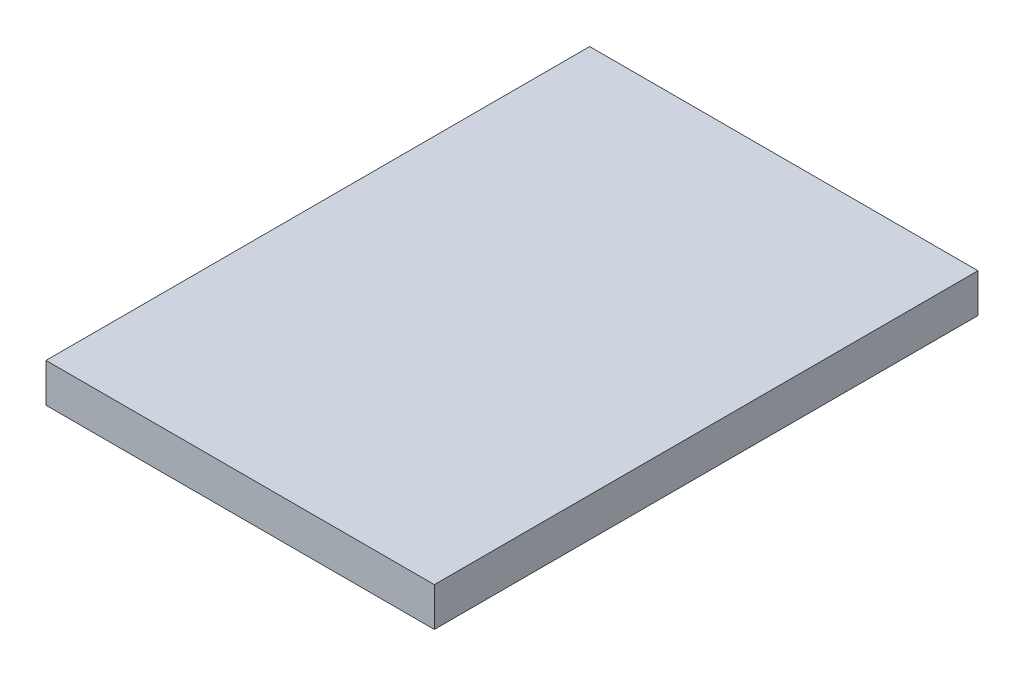
from build123d import *

# Parameters (mm, degrees)
SKETCH1_W           = 20
SKETCH1_H           = 28
BOSS_EXTRUDE1_DEPTH = 1


with BuildPart() as part:
    # Sketch1 → Boss-Extrude1 (new, symmetric)
    with BuildSketch(Plane(origin=(0, 0, 0), x_dir=(1, 0, 0), z_dir=(0, 1, 0))):
        Rectangle(SKETCH1_W, SKETCH1_H)
    extrude(amount=BOSS_EXTRUDE1_DEPTH, both=True)


solid = part.part
